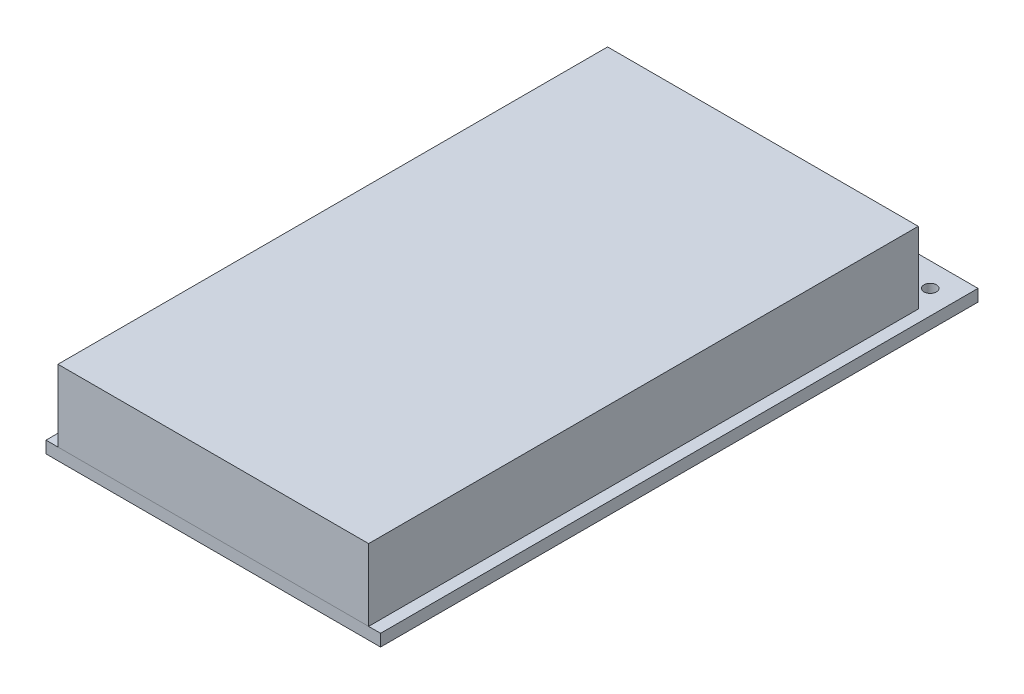
from build123d import *

# Parameters (mm, degrees)
SKETCH1_W               = 177.8
SKETCH1_H               = 317.5
BOSS_EXTRUDE1_DEPTH     = 6.35
SKETCH2_W               = 165.1
SKETCH2_H               = 292.1
BOSS_EXTRUDE2_DEPTH     = 38.1
CUT_EXTRUDE1_DEPTH      = 188.298091288
CUT_EXTRUDE1_DEPTH_BACK = 188.298091288
SKETCH3_R               = 3.302


with BuildPart() as part:
    # Sketch1 → Boss-Extrude1 (new body)
    with BuildSketch(Plane(origin=(0, 0, 0), x_dir=(1, 0, 0), z_dir=(0, 1, 0))):
        Rectangle(SKETCH1_W, SKETCH1_H)
    extrude(amount=BOSS_EXTRUDE1_DEPTH)

    # Sketch3 → Cut-Extrude1 (cut, two sides: drawn at the far end of the back side and taken through both)
    with BuildSketch(Plane.XZ.offset(-CUT_EXTRUDE1_DEPTH_BACK)):
        with Locations(Location((76.2, -146.05, 0), (0, 0, 90))):
            Circle(SKETCH3_R)
        with Locations(Location((-76.2, -146.05, 0), (0, 0, 90))):
            Circle(SKETCH3_R)
    extrude(amount=CUT_EXTRUDE1_DEPTH + CUT_EXTRUDE1_DEPTH_BACK, mode=Mode.SUBTRACT)


with BuildPart() as body_2:
    # Sketch2 → Boss-Extrude2 (new body)
    with BuildSketch(Plane(origin=(0, 6.35, 0), x_dir=(1, 0, 0), z_dir=(0, 1, 0))):
        with Locations((0, -12.7)):
            Rectangle(SKETCH2_W, SKETCH2_H)
    extrude(amount=BOSS_EXTRUDE2_DEPTH)


solid = Compound([part.part, body_2.part])
